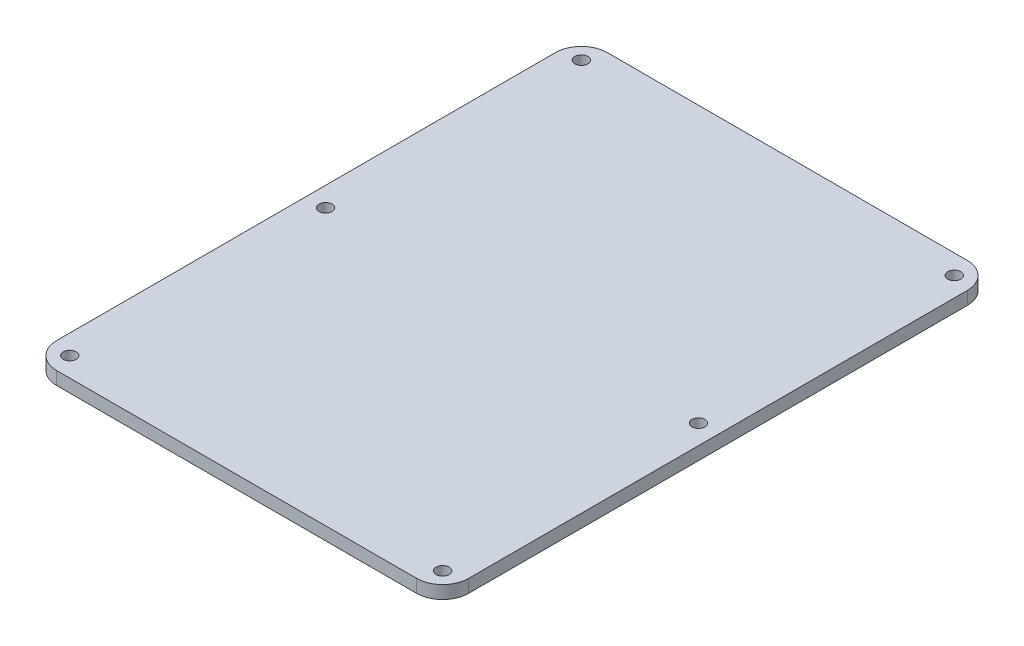
from build123d import *

# Parameters (mm, degrees)
SKETCH1_W               = 95
SKETCH1_H               = 127
BOSS_EXTRUDE1_DEPTH     = 3
FILLET1_R               = 6
SKETCH2_R               = 1.5
CUT_EXTRUDE1_DEPTH      = 80.35678925
LPATTERN2_COUNT         = 2
LPATTERN2_PITCH         = 59
MIRROR2_COPY_1_SKETCH_R = 1.5
MIRROR2_COPY_1_DEPTH    = 80.35678925
MIRROR2_COPY_2_SKETCH_R = 1.5
MIRROR2_COPY_2_DEPTH    = 80.35678925


with BuildPart() as part:
    # Sketch1 → Boss-Extrude1 (new body)
    with BuildSketch(Plane(origin=(0, 0, 0), x_dir=(1, 0, 0), z_dir=(0, 1, 0))):
        Rectangle(SKETCH1_W, SKETCH1_H)
    extrude(amount=BOSS_EXTRUDE1_DEPTH)

    # Fillet1
    fillet1_edges = [part.edges().sort_by_distance(p)[0] for p in [
        (47.5, 1.5, 63.5),
        (-47.5, 1.5, 63.5),
        (-47.5, 1.5, -63.5),
        (47.5, 1.5, -63.5),
    ]]
    fillet(fillet1_edges, radius=FILLET1_R)

    # Sketch2 → Cut-Extrude1 (cut, through all)
    with BuildSketch(Plane(origin=(0, 3, 0), x_dir=(1, 0, 0), z_dir=(0, 1, 0))):
        with Locations(Location((-43, 59, 0), (0, 0, 270))):
            Circle(SKETCH2_R)
    cut_extrude1 = extrude(amount=-CUT_EXTRUDE1_DEPTH, mode=Mode.SUBTRACT)

    # Mirror1: Cut-Extrude1 across plane
    add(cut_extrude1.mirror(Plane.XY), mode=Mode.SUBTRACT)

    # LPattern2: Cut-Extrude1 ×2
    with Locations(*[(0, 0, i * LPATTERN2_PITCH) for i in range(1, LPATTERN2_COUNT)]):
        add(cut_extrude1, mode=Mode.SUBTRACT)

    # Mirror2: Cut-Extrude1 across plane
    add(cut_extrude1.mirror(Plane(origin=(0, 0, 0), x_dir=(0, 0, 1), z_dir=(1, 0, 0))), mode=Mode.SUBTRACT)

    # Mirror2 copy 1 sketch → Mirror2 copy 1 (cut, through all)
    with BuildSketch(Plane(origin=(0, 3, 0), x_dir=(-1, 0, 0), z_dir=(0, 1, 0))):
        with Locations(Location((-43, 59, 0), (0, 0, 270))):
            Circle(MIRROR2_COPY_1_SKETCH_R)
    extrude(amount=-MIRROR2_COPY_1_DEPTH, mode=Mode.SUBTRACT)

    # Mirror2 copy 2 sketch → Mirror2 copy 2 (cut, through all)
    with BuildSketch(Plane(origin=(0, 3, 59), x_dir=(-1, 0, 0), z_dir=(0, 1, 0))):
        with Locations((-43, -59)):
            Circle(MIRROR2_COPY_2_SKETCH_R)
    extrude(amount=-MIRROR2_COPY_2_DEPTH, mode=Mode.SUBTRACT)


solid = part.part
